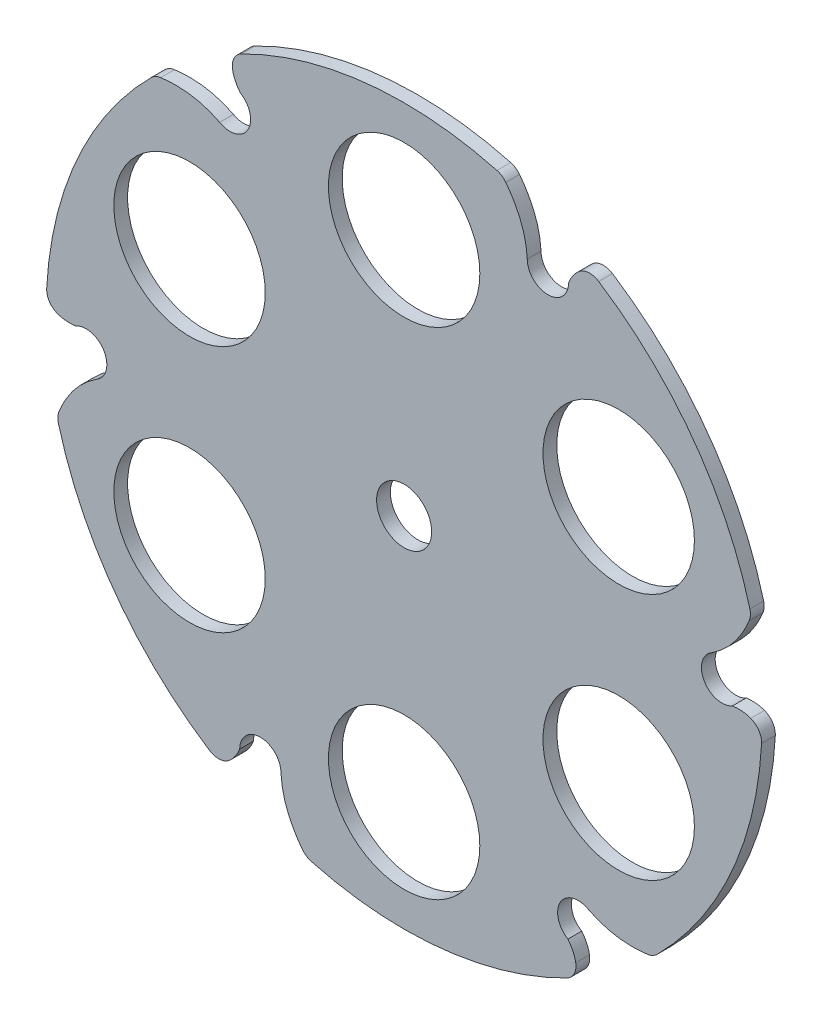
from build123d import *

# Parameters (mm, degrees)
SKETCH1_R           = 165.1
SKETCH1_R_2         = 34.925
SKETCH1_R_3         = 12.7
BOSS_EXTRUDE1_DEPTH = 3.175
CUT_EXTRUDE1_DEPTH  = 234.572991803
CIRPATTERN1_COUNT   = 6
FILLET1_R           = 7.62


with BuildPart() as part:
    # Sketch1 → Boss-Extrude1 (new, symmetric)
    with BuildSketch(Plane.XY):
        Circle(SKETCH1_R)
        with Locations((0, 114.3)):
            Circle(SKETCH1_R_2, mode=Mode.SUBTRACT)
        with Locations((98.986703653, 57.15)):
            Circle(SKETCH1_R_2, mode=Mode.SUBTRACT)
        with Locations((98.986703653, -57.15)):
            Circle(SKETCH1_R_2, mode=Mode.SUBTRACT)
        with Locations((0, -114.3)):
            Circle(SKETCH1_R_2, mode=Mode.SUBTRACT)
        with Locations((-98.986703653, -57.15)):
            Circle(SKETCH1_R_2, mode=Mode.SUBTRACT)
        with Locations((-98.986703653, 57.15)):
            Circle(SKETCH1_R_2, mode=Mode.SUBTRACT)
        Circle(SKETCH1_R_3, mode=Mode.SUBTRACT)
    extrude(amount=BOSS_EXTRUDE1_DEPTH, both=True)

    # Sketch2 → Cut-Extrude1 (cut, through all)
    with BuildSketch(Plane.XY.offset(3.175)):
        with BuildLine():
            ThreePointArc((-56.8071, -131.064), (-66.3321, -121.539), (-75.8571, -131.064))
            add(Edge.make_bspline(
                [(-75.8571, -131.064), (-78.753450449, -138.429499147), (-85.971521231, -140.950017869)],
                knots=[0, 0, 0, 1, 1, 1], degree=2))
            ThreePointArc((-85.971521231, -140.950017869), (-66.21496115, -151.240169664), (-45.253014014, -158.777122794))
            add(Edge.make_bspline(
                [(-56.8071, -131.064), (-56.098700423, -145.821305076), (-45.253014014, -158.777122794)],
                knots=[0, 0, 0, 1, 1, 1], degree=2))
        make_face()
    cut_extrude1 = extrude(amount=-CUT_EXTRUDE1_DEPTH, mode=Mode.SUBTRACT)

    # CirPattern1: Cut-Extrude1 ×6 about axis
    cirpattern1_axis = Axis((0, 0, 3.175), (0, 0, 1))
    for i in range(1, CIRPATTERN1_COUNT):
        add(cut_extrude1.rotate(cirpattern1_axis, i * 360 / CIRPATTERN1_COUNT), mode=Mode.SUBTRACT)

    # Fillet1
    fillet1_edges = [part.edges().sort_by_distance(p)[0] for p in [
        (-160.131528886, -40.198301663, 0),
        (-165.052056754, 3.978512454, 0),
        (-45.253014014, -158.777122794, 0),
        (-85.971521231, -140.950017869, 0),
        (114.878514872, -118.578821131, 0),
        (79.080535523, -144.928530323, 0),
        (160.131528886, 40.198301663, 0),
        (165.052056754, -3.978512454, 0),
        (45.253014014, 158.777122794, 0),
        (85.971521231, 140.950017869, 0),
        (-114.878514872, 118.578821131, 0),
        (-79.080535523, 144.928530323, 0),
    ]]
    fillet(fillet1_edges, radius=FILLET1_R)


solid = part.part
